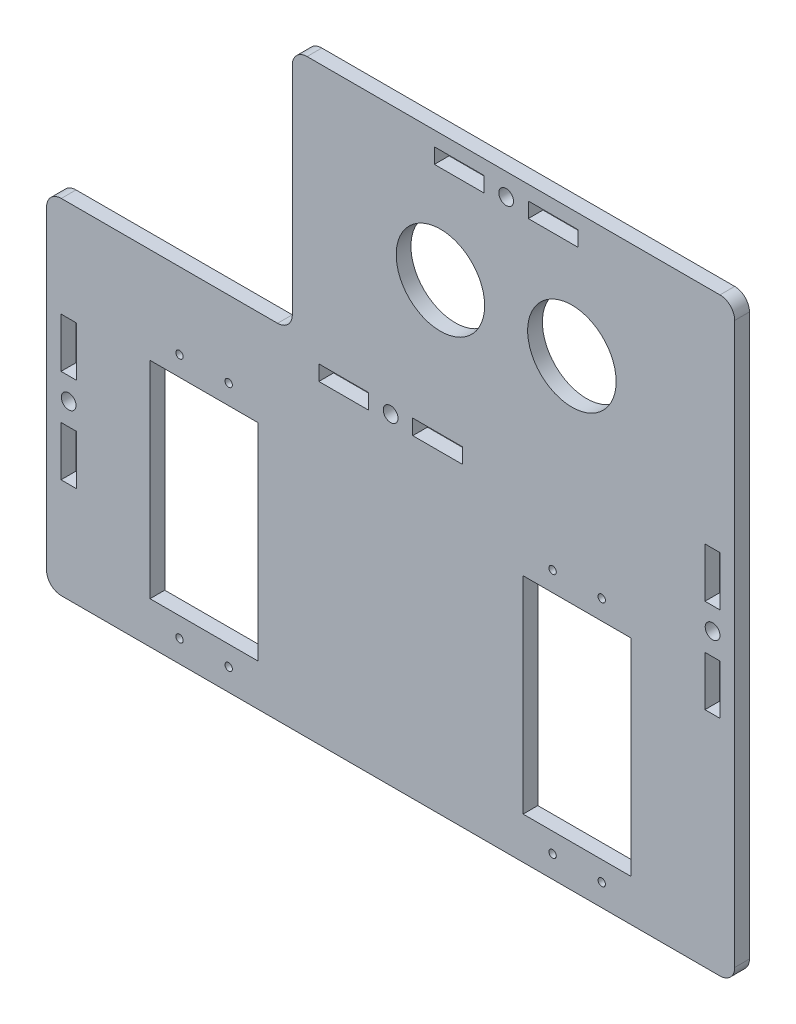
from build123d import *

# Parameters (mm, degrees)
SKETCH1_R           = 0.75
SKETCH1_W           = 3.1
SKETCH1_H           = 10.1
SKETCH1_W_2         = 22
SKETCH1_H_2         = 42
SKETCH1_R_2         = 1.5
SKETCH1_W_3         = 10.1
SKETCH1_H_3         = 3.1
SKETCH1_R_3         = 9
BOSS_EXTRUDE4_DEPTH = 3
FILLET1_R           = 3


with BuildPart() as part:
    # Sketch1 → Boss-Extrude4 (new body)
    with BuildSketch(Plane.XY):
        Polygon((0, 70), (0, 0), (140, 0), (140, 120), (50, 120), (50, 70), align=None)
        with Locations((27.05, 4.5)):
            Circle(SKETCH1_R, mode=Mode.SUBTRACT)
        with Locations((4.5, 25.45)):
            Rectangle(SKETCH1_W, SKETCH1_H, mode=Mode.SUBTRACT)
        with Locations((32.05, 29.500000083)):
            Rectangle(SKETCH1_W_2, SKETCH1_H_2, mode=Mode.SUBTRACT)
        with Locations((37.05, 4.5)):
            Circle(SKETCH1_R, mode=Mode.SUBTRACT)
        with Locations((4.5, 35)):
            Circle(SKETCH1_R_2, mode=Mode.SUBTRACT)
        with Locations((4.5, 44.55)):
            Rectangle(SKETCH1_W, SKETCH1_H, mode=Mode.SUBTRACT)
        with Locations((27.05, 54.500000165)):
            Circle(SKETCH1_R, mode=Mode.SUBTRACT)
        with Locations((37.05, 54.500000165)):
            Circle(SKETCH1_R, mode=Mode.SUBTRACT)
        with Locations((102.95, 4.5)):
            Circle(SKETCH1_R, mode=Mode.SUBTRACT)
        with Locations((112.95, 4.5)):
            Circle(SKETCH1_R, mode=Mode.SUBTRACT)
        with Locations((107.95, 29.500000083)):
            Rectangle(SKETCH1_W_2, SKETCH1_H_2, mode=Mode.SUBTRACT)
        with Locations((102.95, 54.500000165)):
            Circle(SKETCH1_R, mode=Mode.SUBTRACT)
        with Locations((112.95, 54.500000165)):
            Circle(SKETCH1_R, mode=Mode.SUBTRACT)
        with Locations((135.5, 50.45)):
            Rectangle(SKETCH1_W, SKETCH1_H, mode=Mode.SUBTRACT)
        with Locations((60.45, 65.5)):
            Rectangle(SKETCH1_W_3, SKETCH1_H_3, mode=Mode.SUBTRACT)
        with Locations((70, 65.5)):
            Circle(SKETCH1_R_2, mode=Mode.SUBTRACT)
        with Locations((79.55, 65.5)):
            Rectangle(SKETCH1_W_3, SKETCH1_H_3, mode=Mode.SUBTRACT)
        with Locations((135.5, 60)):
            Circle(SKETCH1_R_2, mode=Mode.SUBTRACT)
        with Locations((135.5, 69.55)):
            Rectangle(SKETCH1_W, SKETCH1_H, mode=Mode.SUBTRACT)
        with Locations((80.128224089, 94.16)):
            Circle(SKETCH1_R_3, mode=Mode.SUBTRACT)
        with Locations((83.953224089, 115.5)):
            Rectangle(SKETCH1_W_3, SKETCH1_H_3, mode=Mode.SUBTRACT)
        with Locations((93.503224089, 115.5)):
            Circle(SKETCH1_R_2, mode=Mode.SUBTRACT)
        with Locations((103.053224089, 115.5)):
            Rectangle(SKETCH1_W_3, SKETCH1_H_3, mode=Mode.SUBTRACT)
        with Locations((106.878224089, 94.16)):
            Circle(SKETCH1_R_3, mode=Mode.SUBTRACT)
    extrude(amount=BOSS_EXTRUDE4_DEPTH)

    # Fillet1
    fillet1_edges = [part.edges().sort_by_distance(p)[0] for p in [
        (50, 120, 1.5),
        (140, 120, 1.5),
        (140, 0, 1.5),
        (0, 0, 1.5),
        (0, 70, 1.5),
        (50, 70, 1.5),
    ]]
    fillet(fillet1_edges, radius=FILLET1_R)


solid = part.part
